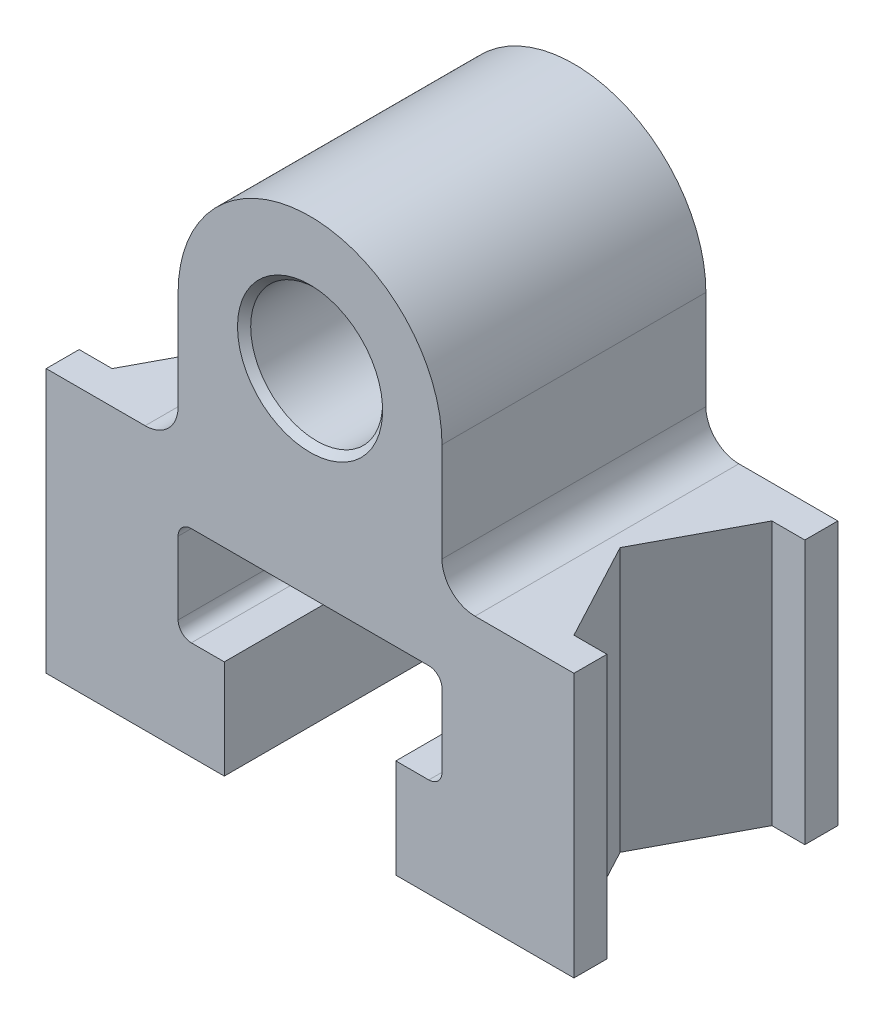
from build123d import *

# Parameters (mm, degrees)
ESBO_O1_W                    = 80
ESBO_O1_H                    = 40
RESSALTO_EXTRUS_O1_DEPTH     = 80
ESBO_O2_W                    = 20
ESBO_O2_H                    = 40
CORTE_EXTRUS_O1_DEPTH        = 80
FILETE1_RADIUS               = 20
FILETE1_LENGTH               = 40
FURO_DE_DI_METRO_20_0_20_1_D = 20
CHANFRO1_SIZE                = 1
CORTE_EXTRUS_O2_DEPTH        = 80
CORTE_EXTRUS_O3_DEPTH        = 80
FILETE2_R                    = 2
FILETE3_R                    = 5


with BuildPart() as part:
    # Esboço1 → Ressalto-extrusão1 (new body)
    with BuildSketch(Plane(origin=(0, 0, 0), x_dir=(1, 0, 0), z_dir=(0, 1, 0))):
        Rectangle(ESBO_O1_W, ESBO_O1_H)
    extrude(amount=RESSALTO_EXTRUS_O1_DEPTH)

    # Esboço2 → Corte-extrusão1 (cut)
    with BuildSketch(Plane.XY.offset(20)):
        with Locations((-30, 60)):
            Rectangle(ESBO_O2_W, ESBO_O2_H)
        with Locations((30, 60)):
            Rectangle(ESBO_O2_W, ESBO_O2_H)
    extrude(amount=-CORTE_EXTRUS_O1_DEPTH, mode=Mode.SUBTRACT)

    # Filete1: full round fillet: the end face becomes a half cylinder, R = half its width
    filete1_face = Plane((0, 80, 0), x_dir=(0, 0, -1), z_dir=(0, 1, 0))  # on the end face: x along it, z out of the body
    filete1_slab = filete1_face.offset(-FILETE1_RADIUS / 2) * Box(FILETE1_LENGTH, 2 * FILETE1_RADIUS, FILETE1_RADIUS, mode=Mode.PRIVATE)  # the body's end, R deep
    filete1_round = Plane((0, 60, 0), x_dir=(0, 1, 0), z_dir=(0, 0, -1)) * Cylinder(FILETE1_RADIUS, FILETE1_LENGTH, mode=Mode.PRIVATE)  # its axis R under the face
    add(filete1_slab - filete1_round, mode=Mode.SUBTRACT)

    # Furo de diâmetro Ø20.0 (20)1 (through all)
    with Locations(Plane.XY.offset(20)):
        with Locations((0, 60)):
            Hole(FURO_DE_DI_METRO_20_0_20_1_D / 2)

    # Chanfro1
    chanfro1_edges = [part.edges().sort_by_distance(p)[0] for p in [
        (10, 60, 20),
        (10, 60, -20),
    ]]
    chamfer(chanfro1_edges, length=CHANFRO1_SIZE)

    # Esboço5 → Corte-extrusão2 (cut)
    with BuildSketch(Plane(origin=(0, 40, 0), x_dir=(1, 0, 0), z_dir=(0, 1, 0))):
        Polygon((40, 15), (35, 15), (27, 0), (35, -15), (40, -15), align=None)
    corte_extrus_o2 = extrude(amount=-CORTE_EXTRUS_O2_DEPTH, mode=Mode.SUBTRACT)

    # Espelhar1: Corte-extrusão2 across plane
    add(corte_extrus_o2.mirror(Plane(origin=(0, 0, 0), x_dir=(0, 0, 1), z_dir=(1, 0, 0))), mode=Mode.SUBTRACT)

    # Esboço6 → Corte-extrusão3 (cut)
    with BuildSketch(Plane.XY.offset(20)):
        Polygon((-13, 0), (-13, 15), (-20, 15), (-20, 30), (20, 30), (20, 15), (13, 15), (13, 0), align=None)
    extrude(amount=-CORTE_EXTRUS_O3_DEPTH, mode=Mode.SUBTRACT)

    # Filete2
    filete2_edges = [part.edges().sort_by_distance(p)[0] for p in [
        (-20, 15, 0),
        (-20, 30, 0),
        (20, 30, 0),
        (20, 15, 0),
    ]]
    fillet(filete2_edges, radius=FILETE2_R)

    # Filete3
    filete3_edges = [part.edges().sort_by_distance(p)[0] for p in [
        (-20, 40, 0),
        (20, 40, 0),
    ]]
    fillet(filete3_edges, radius=FILETE3_R)


solid = part.part
